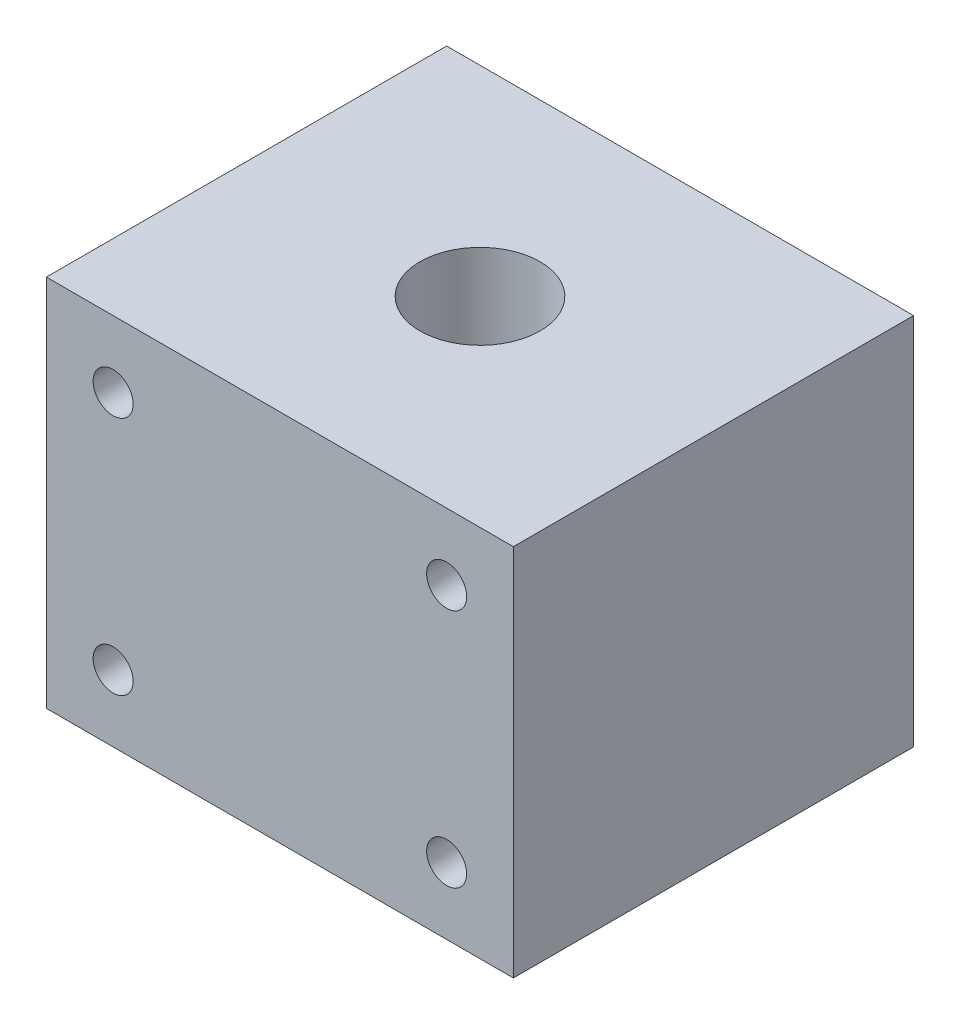
from build123d import *

# Parameters (mm, degrees)
SKETCH1_W               = 35
SKETCH1_H               = 30
BOSS_EXTRUDE1_DEPTH     = 28
SKETCH2_R               = 1.5
CUT_EXTRUDE1_DEPTH      = 10
SKETCH5_R               = 11.5
CUT_EXTRUDE4_DEPTH      = 3
CUT_EXTRUDE5_DEPTH      = 35.003676272
CUT_EXTRUDE5_DEPTH_BACK = 35.003676272
SKETCH6_R               = 4.5


with BuildPart() as part:
    # Sketch1 → Boss-Extrude1 (new body)
    with BuildSketch(Plane(origin=(0, 0, 0), x_dir=(1, 0, 0), z_dir=(0, 1, 0))):
        Rectangle(SKETCH1_W, SKETCH1_H)
    extrude(amount=BOSS_EXTRUDE1_DEPTH)

    # Sketch2 → Cut-Extrude1 (cut)
    with BuildSketch(Plane.XY.offset(15)):
        with Locations((-12.5, 23)):
            Circle(SKETCH2_R)
        with Locations((12.5, 23)):
            Circle(SKETCH2_R)
        with Locations((12.5, 5)):
            Circle(SKETCH2_R)
        with Locations((-12.5, 5)):
            Circle(SKETCH2_R)
    extrude(amount=-CUT_EXTRUDE1_DEPTH, mode=Mode.SUBTRACT)

    # Sketch5 → Cut-Extrude4 (cut)
    with BuildSketch(Plane.XZ):
        with Locations(Location((0, 0, 0), (0, 0, 270))):
            Circle(SKETCH5_R)
    extrude(amount=-CUT_EXTRUDE4_DEPTH, mode=Mode.SUBTRACT)

    # Sketch6 → Cut-Extrude5 (cut, two sides: drawn at the far end of the back side and taken through both)
    with BuildSketch(Plane(origin=(0, 3, 0), x_dir=(-1, 0, 0), z_dir=(0, -1, 0)).offset(-CUT_EXTRUDE5_DEPTH_BACK)):
        with Locations(Location((0, 0, 0), (0, 0, 90))):
            Circle(SKETCH6_R)
    extrude(amount=CUT_EXTRUDE5_DEPTH + CUT_EXTRUDE5_DEPTH_BACK, mode=Mode.SUBTRACT)


solid = part.part
